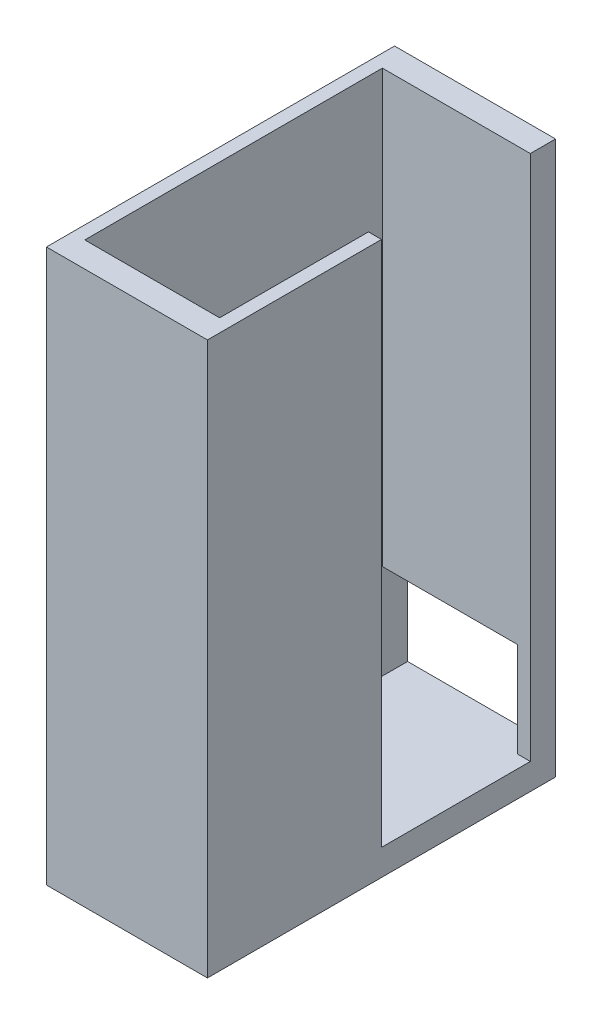
from build123d import *

# Parameters (mm, degrees)
SKETCH1_W           = 18.5
SKETCH1_H           = 40
BOSS_EXTRUDE1_DEPTH = 3
SKETCH2_W           = 1.5
SKETCH2_H           = 17.1
BOSS_EXTRUDE2_DEPTH = 60.5
CUT_EXTRUDE1_REACH  = 79.295
SKETCH4_W           = 15.5
SKETCH4_H           = 10.9


with BuildPart() as part:
    # Sketch1 → Boss-Extrude1 (new body)
    with BuildSketch(Plane(origin=(0, 0, 0), x_dir=(1, 0, 0), z_dir=(0, 1, 0))):
        with Locations((9.25, 20)):
            Rectangle(SKETCH1_W, SKETCH1_H)
    extrude(amount=BOSS_EXTRUDE1_DEPTH)

    # Sketch2 → Boss-Extrude2 (add)
    with BuildSketch(Plane(origin=(0, 3, 0), x_dir=(1, 0, 0), z_dir=(0, 1, 0))):
        Polygon((18.5, 40), (0, 40), (0, 37.1), (1.5, 37.1), (18.5, 37.1), align=None)
        Polygon((1.5, 37.1), (0, 37.1), (0, 0), (1.5, 0), (1.5, 2.9), align=None)
        Polygon((17, 2.9), (1.5, 2.9), (1.5, 0), (18.5, 0), (18.5, 2.9), align=None)
        with Locations((17.75, 11.45)):
            Rectangle(SKETCH2_W, SKETCH2_H)
    extrude(amount=BOSS_EXTRUDE2_DEPTH)

    # Sketch4 → Cut-Extrude1 (cut, up to next)
    with BuildSketch(Plane(origin=(0, 0, -40), x_dir=(-1, 0, 0), z_dir=(0, 0, -1)), mode=Mode.PRIVATE) as cut_extrude1_sk1:
        with Locations((-9.25, 8.45)):
            Rectangle(SKETCH4_W, SKETCH4_H)
    cut_extrude1_tool1 = extrude(cut_extrude1_sk1.sketch, amount=-CUT_EXTRUDE1_REACH, mode=Mode.PRIVATE) & part.part
    add(cut_extrude1_tool1.solids().sort_by_distance((9.25, 8.45, -40))[0], mode=Mode.SUBTRACT)


solid = part.part
